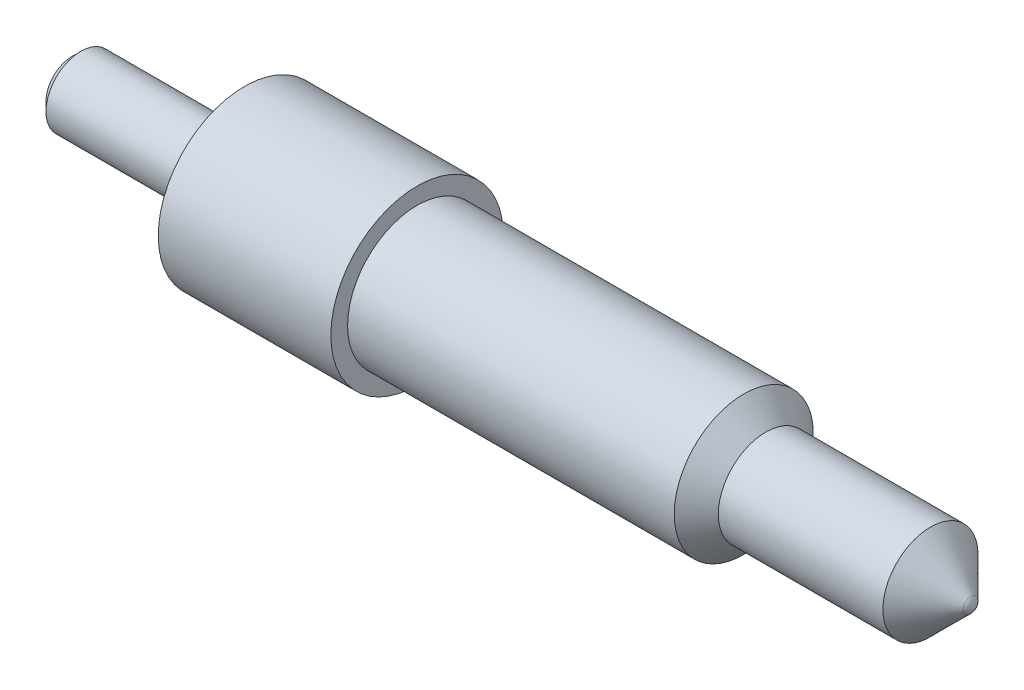
from build123d import *


with BuildPart() as part:
    # Sketch1 → Revolve1 (revolve)
    with BuildSketch(Plane.XY, mode=Mode.PRIVATE) as revolve1_sk:
        with BuildLine():
            Line((0, 0), (0, 0.37465))
            Line((0, 0.37465), (0.127, 0.50165))
            Line((0.127, 0.50165), (2.4892, 0.50165))
            Line((2.4892, 0.50165), (2.4892, 1.2446))
            Line((2.4892, 1.2446), (4.9784, 1.2446))
            Line((4.9784, 1.2446), (4.9784, 1.0033))
            Line((4.9784, 1.0033), (9.6901, 1.0033))
            Line((9.6901, 1.0033), (10.0076, 0.6858))
            Line((10.0076, 0.6858), (12.382126147, 0.6858))
            Line((12.382126147, 0.6858), (12.960163073, 0.107763073))
            ThreePointArc((12.960163073, 0.107763073), (12.993199241, 0.058320955), (13.0048, 0))
            Line((13.0048, 0), (0, 0))
        make_face()
    revolve(revolve1_sk.sketch.rotate(Axis((-3.44790705, 0, 0), (1, 0, 0)), 90), axis=Axis((-3.44790705, 0, 0), (1, 0, 0)))


solid = part.part
